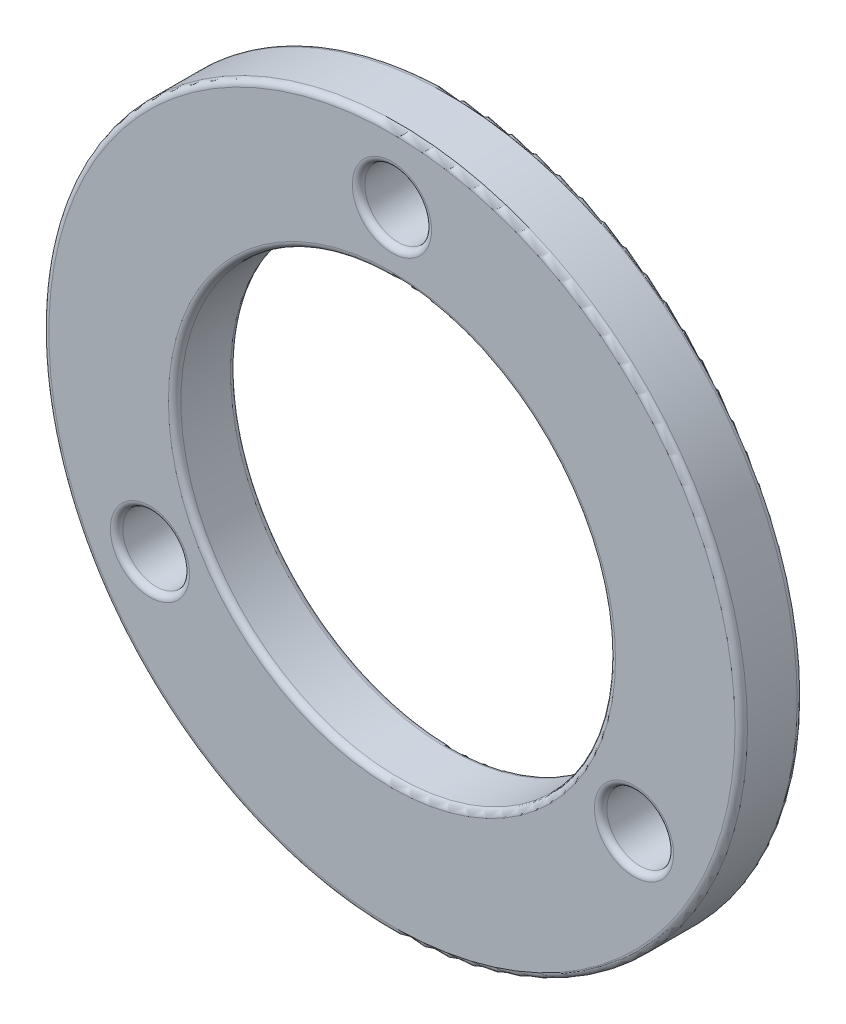
from build123d import *

# Parameters (mm, degrees)
SKETCH1_R           = 112.5
SKETCH1_R_2         = 10.75
SKETCH1_R_3         = 70
BOSS_EXTRUDE1_DEPTH = 20
FILLET8_R           = 2


with BuildPart() as part:
    # Sketch1 → Boss-Extrude1 (new body)
    with BuildSketch(Plane.XY):
        Circle(SKETCH1_R)
        with Locations((0, 90)):
            Circle(SKETCH1_R_2, mode=Mode.SUBTRACT)
        with Locations((77.942286341, -45)):
            Circle(SKETCH1_R_2, mode=Mode.SUBTRACT)
        with Locations((-77.942286341, -45)):
            Circle(SKETCH1_R_2, mode=Mode.SUBTRACT)
        Circle(SKETCH1_R_3, mode=Mode.SUBTRACT)
    extrude(amount=BOSS_EXTRUDE1_DEPTH)

    # Fillet8
    fillet8_edges = [part.edges().sort_by_distance(p)[0] for p in [
        (-88.692286341, -45, 0),
        (-88.692286341, -45, 20),
        (-70, 0, 0),
        (-70, 0, 20),
        (-112.5, 0, 0),
        (-112.5, 0, 20),
        (-10.75, 90, 0),
        (-10.75, 90, 20),
        (67.192286341, -45, 0),
        (67.192286341, -45, 20),
    ]]
    fillet(fillet8_edges, radius=FILLET8_R)


solid = part.part
